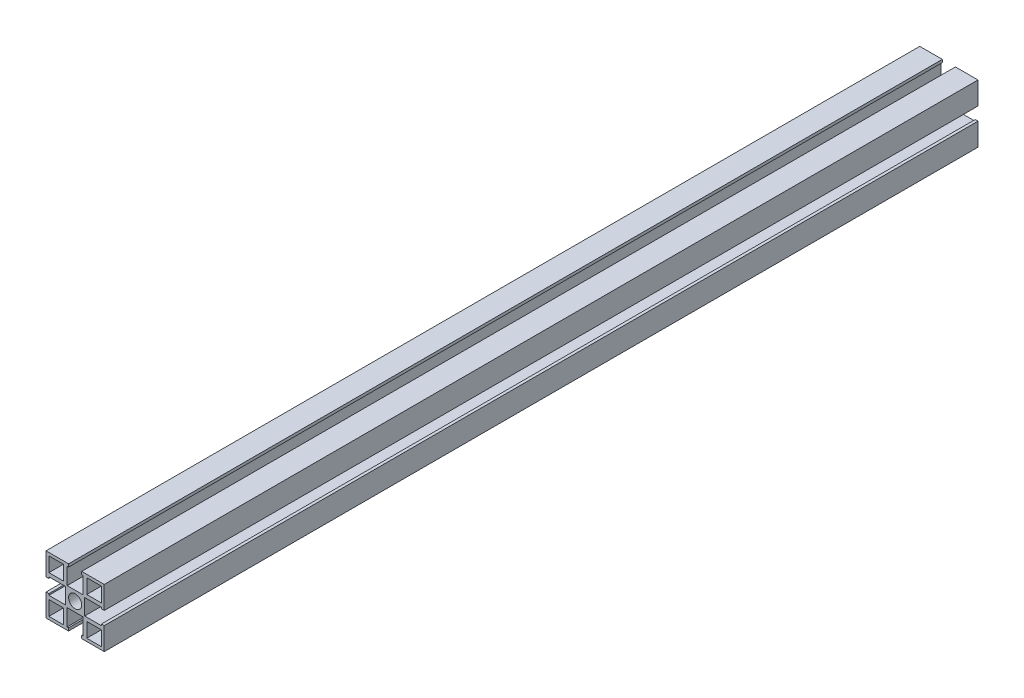
from build123d import *

# Parameters (mm, degrees)
SKETCH_1_R      = 4.5
SKETCH_1_W      = 10
SKETCH_1_H      = 10
EXTRUDE_1_DEPTH = 600


with BuildPart() as part:
    # 草图1 → 凸台-拉伸1 (new body)
    with BuildSketch(Plane.XY):
        Polygon((0, 0), (15.5, 0), (15.5, 1.949576264), (14.5, 1.949576264), (14.5, 13.449576264), (25.5, 13.449576264), (25.5, 1.949576264), (24.5, 1.949576264), (24.5, 0), (40, 0), (40, 15.5), (38.050423736, 15.5), (38.050423736, 14.5), (26.550423736, 14.5), (26.550423736, 25.5), (38.050423736, 25.5), (38.050423736, 24.5), (40, 24.5), (40, 40), (24.5, 40), (24.5, 38.050423736), (25.5, 38.050423736), (25.5, 26.550423736), (14.5, 26.550423736), (14.5, 38.050423736), (15.5, 38.050423736), (15.5, 40), (0, 40), (0, 24.5), (1.949576264, 24.5), (1.949576264, 25.5), (13.449576264, 25.5), (13.449576264, 14.5), (1.949576264, 14.5), (1.949576264, 15.5), (0, 15.5), align=None)
        with Locations((20, 20)):
            Circle(SKETCH_1_R, mode=Mode.SUBTRACT)
        with Locations((7, 33)):
            Rectangle(SKETCH_1_W, SKETCH_1_H, mode=Mode.SUBTRACT)
        with Locations((7, 7)):
            Rectangle(SKETCH_1_W, SKETCH_1_H, mode=Mode.SUBTRACT)
        with Locations((33, 33)):
            Rectangle(SKETCH_1_W, SKETCH_1_H, mode=Mode.SUBTRACT)
        with Locations((33, 7)):
            Rectangle(SKETCH_1_W, SKETCH_1_H, mode=Mode.SUBTRACT)
    extrude(amount=EXTRUDE_1_DEPTH)


solid = part.part
